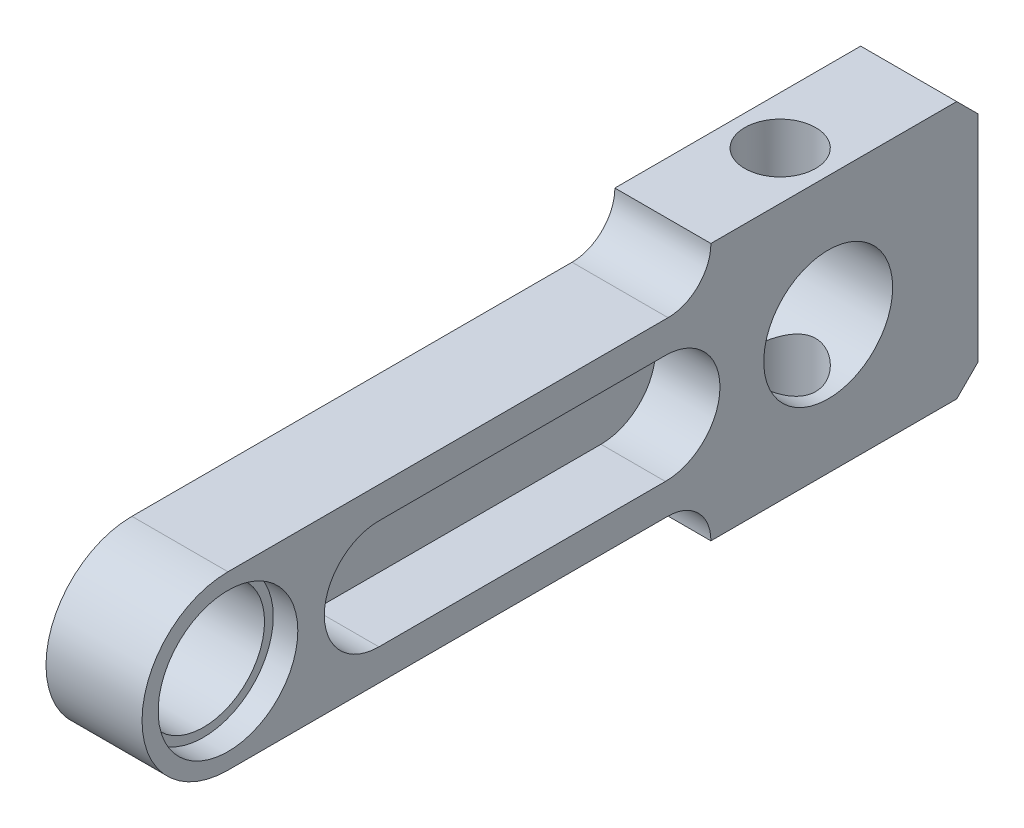
from build123d import *

# Parameters (mm, degrees)
SKETCH1_R           = 2.8448
SKETCH1_R_2         = 2.999999969
BOSS_EXTRUDE1_DEPTH = 4.4704
SKETCH2_R           = 3.2512
CUT_EXTRUDE1_DEPTH  = 1.143
CUT_EXTRUDE2_DEPTH  = 2.9972
SKETCH5_R           = 1.651
CUT_EXTRUDE3_DEPTH  = 38.18359042
SCALE1_SCALE        = 0.6


with BuildPart() as part:
    # Sketch1 → Boss-Extrude1 (new body)
    with BuildSketch(Plane(origin=(0, 0, 0), x_dir=(0, 0, -1), z_dir=(1, 0, 0))):
        with BuildLine():
            Line((0, 4.000000128), (20.485599872, 4.000000128))
            ThreePointArc((20.485599872, 4.000000128), (21.895853546, 4.584146326), (22.479999744, 5.9944))
            Line((22.479999744, 5.9944), (33.922199872, 5.9944))
            Line((33.922199872, 5.9944), (34.912799872, 5.0038))
            Line((34.912799872, 5.0038), (34.912799872, -5.0038))
            Line((34.912799872, -5.0038), (33.922199872, -5.9944))
            Line((33.922199872, -5.9944), (22.479999744, -5.9944))
            ThreePointArc((22.479999744, -5.9944), (21.895853546, -4.584146326), (20.485599872, -4.000000128))
            Line((20.485599872, -4.000000128), (0, -4.000000128))
            ThreePointArc((0, -4.000000128), (-4.000000128, 0), (0, 4.000000128))
        make_face()
        Circle(SKETCH1_R, mode=Mode.SUBTRACT)
        with Locations((27.94, 0)):
            Circle(SKETCH1_R_2, mode=Mode.SUBTRACT)
    extrude(amount=BOSS_EXTRUDE1_DEPTH)

    # Sketch2 → Cut-Extrude1 (cut)
    with BuildSketch(Plane(origin=(4.4704, 0, 0), x_dir=(0, 0, -1), z_dir=(1, 0, 0))):
        Circle(SKETCH2_R)
    extrude(amount=-CUT_EXTRUDE1_DEPTH, mode=Mode.SUBTRACT)

    # Sketch4 → Cut-Extrude2 (cut)
    with BuildSketch(Plane(origin=(4.4704, 0, 0), x_dir=(0, 0, -1), z_dir=(1, 0, 0))):
        with BuildLine():
            Line((7.0259921, 2.54), (20.3609921, 2.54))
            ThreePointArc((20.3609921, 2.54), (22.9009921, 0), (20.3609921, -2.54))
            Line((20.3609921, -2.54), (7.0259921, -2.54))
            ThreePointArc((7.0259921, -2.54), (4.4859921, 0), (7.0259921, 2.54))
        make_face()
    extrude(amount=-CUT_EXTRUDE2_DEPTH, mode=Mode.SUBTRACT)

    # Sketch5 → Cut-Extrude3 (cut, through all)
    with BuildSketch(Plane.XZ.offset(5.9944)):
        with Locations(Location((2.2352, -27.94, 0), (0, 0, 270))):
            Circle(SKETCH5_R)
    extrude(amount=-CUT_EXTRUDE3_DEPTH, mode=Mode.SUBTRACT)


with BuildPart() as part_1:
    # Scale1: scaled about (2.030165897, 0, -18.973898941)
    add(part.part.scale(SCALE1_SCALE).moved(Location((0.812066359, 0, -7.589559576))))


solid = part_1.part
